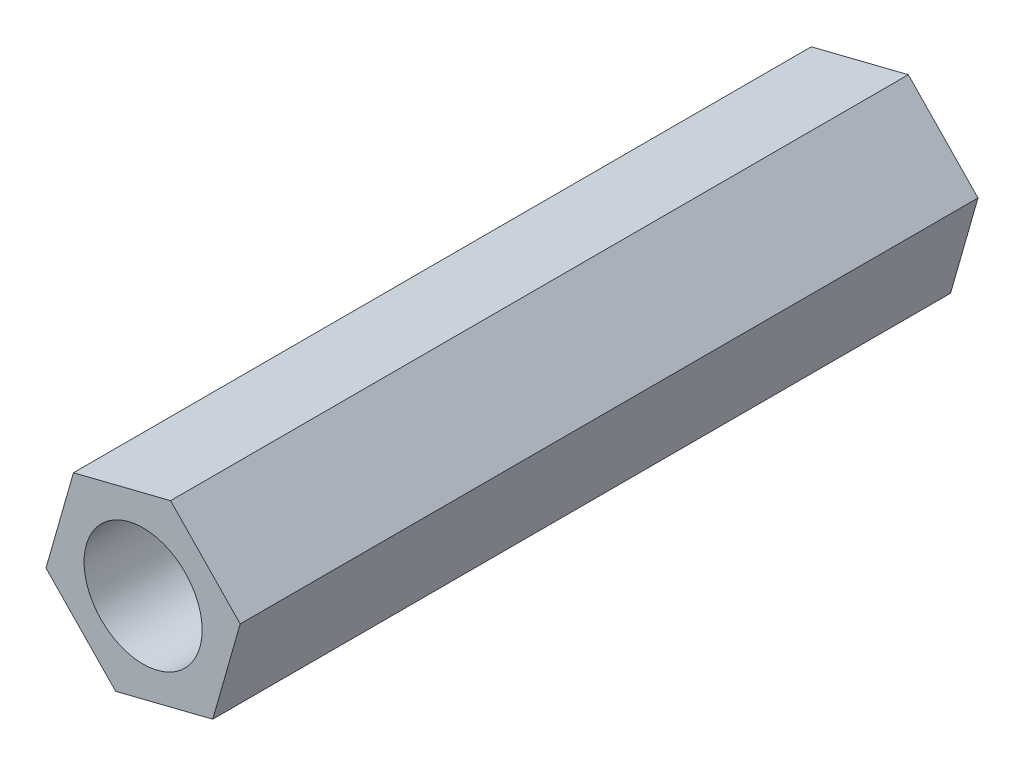
from build123d import *

# Parameters (mm, degrees)
SKETCH1_R           = 1.6
BOSS_EXTRUDE1_DEPTH = 20


with BuildPart() as part:
    # Sketch1 → Boss-Extrude1 (new body)
    with BuildSketch(Plane.XY):
        Polygon((1.887874875, -1.949169513), (2.631967752, 0.660362844), (0.744092878, 2.609532357), (-1.887874875, 1.949169513), (-2.631967752, -0.660362844), (-0.744092878, -2.609532357), align=None)
        Circle(SKETCH1_R, mode=Mode.SUBTRACT)
    extrude(amount=BOSS_EXTRUDE1_DEPTH)


solid = part.part
